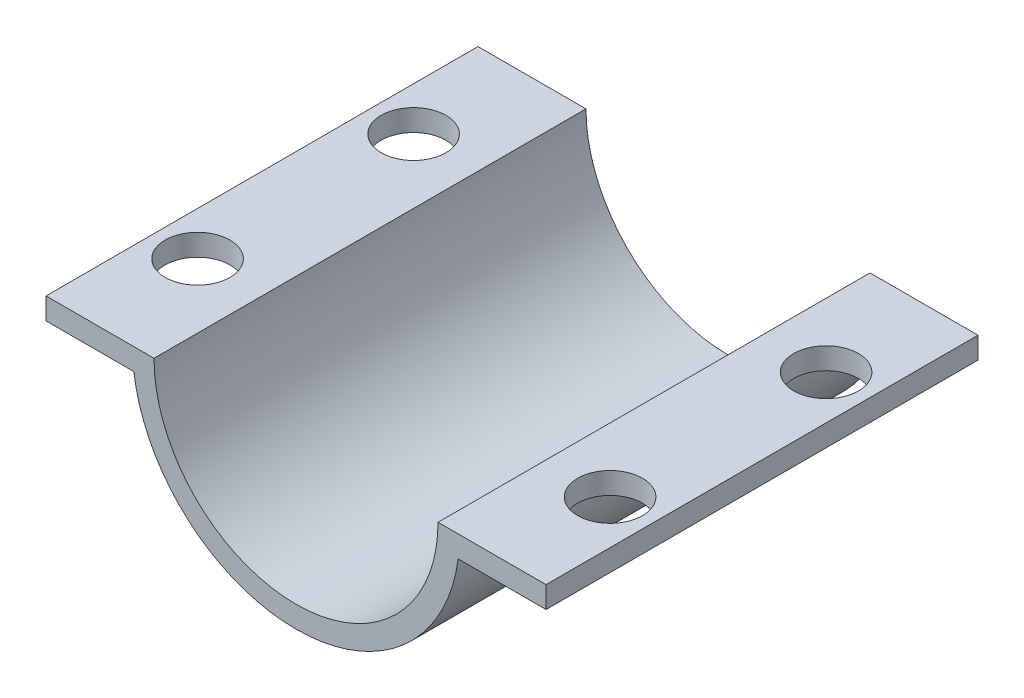
from build123d import *

# Parameters (mm, degrees)
EXTRUDE_THIN1_DEPTH = 25.4
SKETCH2_R           = 3.81
CUT_EXTRUDE1_DEPTH  = 8.128


with BuildPart() as part:
    # Sketch1 → Extrude-Thin1 (new, symmetric)
    with BuildSketch(Plane.XY):
        with BuildLine():
            Line((29.4005, 0), (16.7005, 0))
            ThreePointArc((16.7005, 0), (0, -16.7005), (-16.7005, 0))
            Line((-16.7005, 0), (-29.4005, 0))
            Line((-29.4005, 0), (-29.4005, -2.54))
            Line((-29.4005, -2.54), (-19.07210634, -2.54))
            ThreePointArc((-19.07210634, -2.54), (0, -19.2405), (19.07210634, -2.54))
            Line((19.07210634, -2.54), (29.4005, -2.54))
            Line((29.4005, -2.54), (29.4005, 0))
        make_face()
    extrude(amount=EXTRUDE_THIN1_DEPTH, both=True)

    # Sketch2 → Cut-Extrude1 (cut)
    with BuildSketch(Plane.XZ.offset(2.54)):
        with Locations(Location((24.23630317, -12.7, 0), (0, 0, 270))):
            Circle(SKETCH2_R)
        with Locations(Location((24.23630317, 12.7, 0), (0, 0, 270))):
            Circle(SKETCH2_R)
        with Locations(Location((-24.27769683, 12.7, 0), (0, 0, 270))):
            Circle(SKETCH2_R)
        with Locations(Location((-24.27769683, -12.7, 0), (0, 0, 270))):
            Circle(SKETCH2_R)
    extrude(amount=-CUT_EXTRUDE1_DEPTH, mode=Mode.SUBTRACT)


solid = part.part
